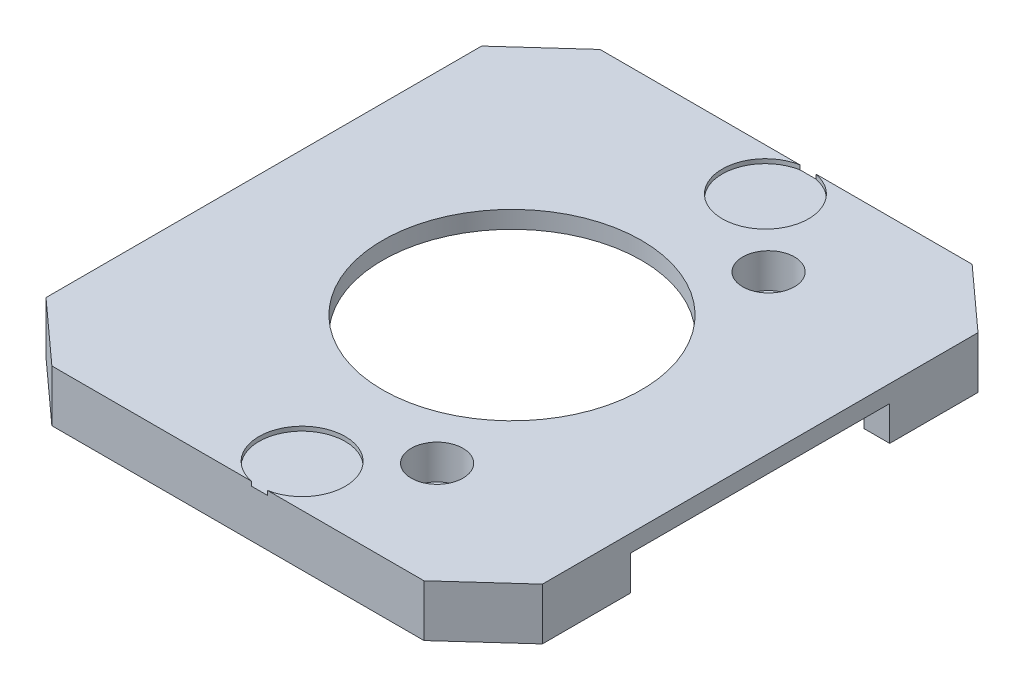
from build123d import *

# Parameters (mm, degrees)
SKETCH_1_R          = 3
EXTRUDE_1_DEPTH     = 6
SKETCH_2_R          = 1.6
CUT_EXTRUDE_1_DEPTH = 7
SKETCH_3_R          = 3
SKETCH_3_R_2        = 1.6
CUT_EXTRUDE_2_DEPTH = 4
CUT_EXTRUDE_3_DEPTH = 4
SKETCH_6_R          = 5
CUT_EXTRUDE_4_DEPTH = 0.5
CUT_EXTRUDE_6_DEPTH = 4
EXTRUDE_START       = -0.5
SKETCH_8_R          = 3
EXTRUDE_2_DEPTH     = 0.5
SKETCH_9_R          = 1.6
EXTRUDE_3_DEPTH     = 0.5
SKETCH_10_R         = 15
CUT_EXTRUDE_7_DEPTH = 44.018891199


with BuildPart() as part:
    # 草图1 → 凸台-拉伸1 (new body)
    with BuildSketch(Plane(origin=(0, 0, 0), x_dir=(1, 0, 0), z_dir=(0, 1, 0))):
        Polygon((21.550377817, 31.75), (-21.550377817, 31.75), (-28.75, 25.230657078), (-28.75, -25.230657078), (-21.550377817, -31.75), (21.550377817, -31.75), (28.75, -25.230657078), (28.75, 25.230657078), align=None)
        with Locations(Location((2.52, -26.835, 0), (0, 0, 270))):
            Circle(SKETCH_1_R, mode=Mode.SUBTRACT)
        with Locations(Location((2.52, 26.835, 0), (0, 0, 270))):
            Circle(SKETCH_1_R, mode=Mode.SUBTRACT)
    extrude(amount=EXTRUDE_1_DEPTH)

    # 草图2 → 切除-拉伸1 (cut)
    with BuildSketch(Plane(origin=(0, 6, 0), x_dir=(1, 0, 0), z_dir=(0, 1, 0))):
        with Locations(Location((10.52, 19.2, 0), (0, 0, 270))):
            Circle(SKETCH_2_R)
        with Locations(Location((10.52, -19.2, 0), (0, 0, 270))):
            Circle(SKETCH_2_R)
    extrude(amount=-CUT_EXTRUDE_1_DEPTH, mode=Mode.SUBTRACT)

    # 草图3 → 切除-拉伸2 (cut)
    # profile 1 of 2: a face of its own
    with BuildSketch(Plane(origin=(0, 6, 0), x_dir=(1, 0, 0), z_dir=(0, 1, 0))):
        with Locations(Location((10.52, 19.2, 0), (0, 0, 270))):
            Circle(SKETCH_3_R)
        with Locations(Location((10.52, 19.2, 0), (0, 0, 270))):
            Circle(SKETCH_3_R_2, mode=Mode.SUBTRACT)
    # profile 2 of 2: a face of its own
    with BuildSketch(Plane(origin=(0, 6, 0), x_dir=(1, 0, 0), z_dir=(0, 1, 0))):
        with Locations(Location((10.52, -19.2, 0), (0, 0, 270))):
            Circle(SKETCH_3_R)
        with Locations(Location((10.52, -19.2, 0), (0, 0, 270))):
            Circle(SKETCH_3_R_2, mode=Mode.SUBTRACT)
    extrude(amount=-CUT_EXTRUDE_2_DEPTH, mode=Mode.SUBTRACT)

    # 草图5 → 切除-拉伸3 (cut)
    with BuildSketch(Plane.XZ):
        Polygon((7.138802154, 26.835), (4.829401077, 30.835), (0.210598923, 30.835), (-2.098802154, 26.835), (0.210598923, 22.835), (4.829401077, 22.835), align=None)
        Polygon((7.138802154, -26.835), (4.829401077, -22.835), (0.210598923, -22.835), (-2.098802154, -26.835), (0.210598923, -30.835), (4.829401077, -30.835), align=None)
    extrude(amount=-CUT_EXTRUDE_3_DEPTH, mode=Mode.SUBTRACT)

    # 草图6 → 切除-拉伸4 (cut)
    with BuildSketch(Plane(origin=(0, 6, 0), x_dir=(1, 0, 0), z_dir=(0, 1, 0))):
        with Locations((2.52, 26.835)):
            Circle(SKETCH_6_R)
        with Locations((2.52, -26.835)):
            Circle(SKETCH_6_R)
    extrude(amount=-CUT_EXTRUDE_4_DEPTH, mode=Mode.SUBTRACT)

    # 草图7 → 切除-拉伸6 (cut)
    with BuildSketch(Plane.XZ):
        with BuildLine():
            Line((9.771398141, -28.75), (20.393940666, -28.75))
            Line((20.393940666, -28.75), (25.75, -23.900025013))
            Line((25.75, -23.900025013), (25.75, -15))
            Line((25.75, -15), (28.75, -15))
            Line((28.75, -15), (28.75, 15))
            Line((28.75, 15), (25.75, 15))
            Line((25.75, 15), (25.75, 23.900025013))
            Line((25.75, 23.900025013), (20.393940666, 28.75))
            Line((20.393940666, 28.75), (9.771398141, 28.75))
            ThreePointArc((9.771398141, 28.75), (9.957589867, 27.800534552), (10.02, 26.835))
            ThreePointArc((10.02, 26.835), (9.972506325, 25.992296328), (9.830626806, 25.160265481))
            ThreePointArc((9.830626806, 25.160265481), (14.51147597, 23.679745482), (16.52, 19.2))
            ThreePointArc((16.52, 19.2), (10.314635532, 13.203515577), (4.534058188, 19.610488278))
            ThreePointArc((4.534058188, 19.610488278), (-2.746887228, 21.495533835), (-4.731398141, 28.75))
            Line((-4.731398141, 28.75), (-20.393940666, 28.75))
            Line((-20.393940666, 28.75), (-25.75, 23.900025013))
            Line((-25.75, 23.900025013), (-25.75, 15))
            Line((-25.75, 15), (-28.75, 15))
            Line((-28.75, 15), (-28.75, -15))
            Line((-28.75, -15), (-25.75, -15))
            Line((-25.75, -15), (-25.75, -23.900025013))
            Line((-25.75, -23.900025013), (-20.393940666, -28.75))
            Line((-20.393940666, -28.75), (-4.731398141, -28.75))
            ThreePointArc((-4.731398141, -28.75), (-2.746887228, -21.495533835), (4.534058188, -19.610488278))
            ThreePointArc((4.534058188, -19.610488278), (10.314635532, -13.203515577), (16.52, -19.2))
            ThreePointArc((16.52, -19.2), (14.51147597, -23.679745482), (9.830626806, -25.160265481))
            ThreePointArc((9.830626806, -25.160265481), (9.972506325, -25.992296328), (10.02, -26.835))
            ThreePointArc((10.02, -26.835), (9.957589867, -27.800534552), (9.771398141, -28.75))
        make_face()
    extrude(amount=-CUT_EXTRUDE_6_DEPTH, mode=Mode.SUBTRACT)

    # 草图8 → 凸台-拉伸2 (add)
    with BuildSketch(Plane(origin=(0, 5.5, 0), x_dir=(1, 0, 0), z_dir=(0, 1, 0)).offset(EXTRUDE_START)):
        with Locations(Location((2.52, 26.835, 0), (0, 0, 90))):
            Circle(SKETCH_8_R)
        with Locations(Location((2.52, -26.835, 0), (0, 0, 90))):
            Circle(SKETCH_8_R)
    extrude(amount=EXTRUDE_2_DEPTH)

    # 草图9 → 凸台-拉伸3 (add)
    with BuildSketch(Plane(origin=(0, 2, 0), x_dir=(1, 0, 0), z_dir=(0, 1, 0))):
        with Locations(Location((10.52, -19.2, 0), (0, 0, 270))):
            Circle(SKETCH_9_R)
        with Locations(Location((10.52, 19.2, 0), (0, 0, 270))):
            Circle(SKETCH_9_R)
    extrude(amount=-EXTRUDE_3_DEPTH)

    # 草图10 → 切除-拉伸7 (cut, through all)
    with BuildSketch(Plane.XZ.offset(-4)):
        with Locations(Location((0, 0, 0), (0, 0, 270))):
            Circle(SKETCH_10_R)
    extrude(amount=-CUT_EXTRUDE_7_DEPTH, mode=Mode.SUBTRACT)


solid = part.part
